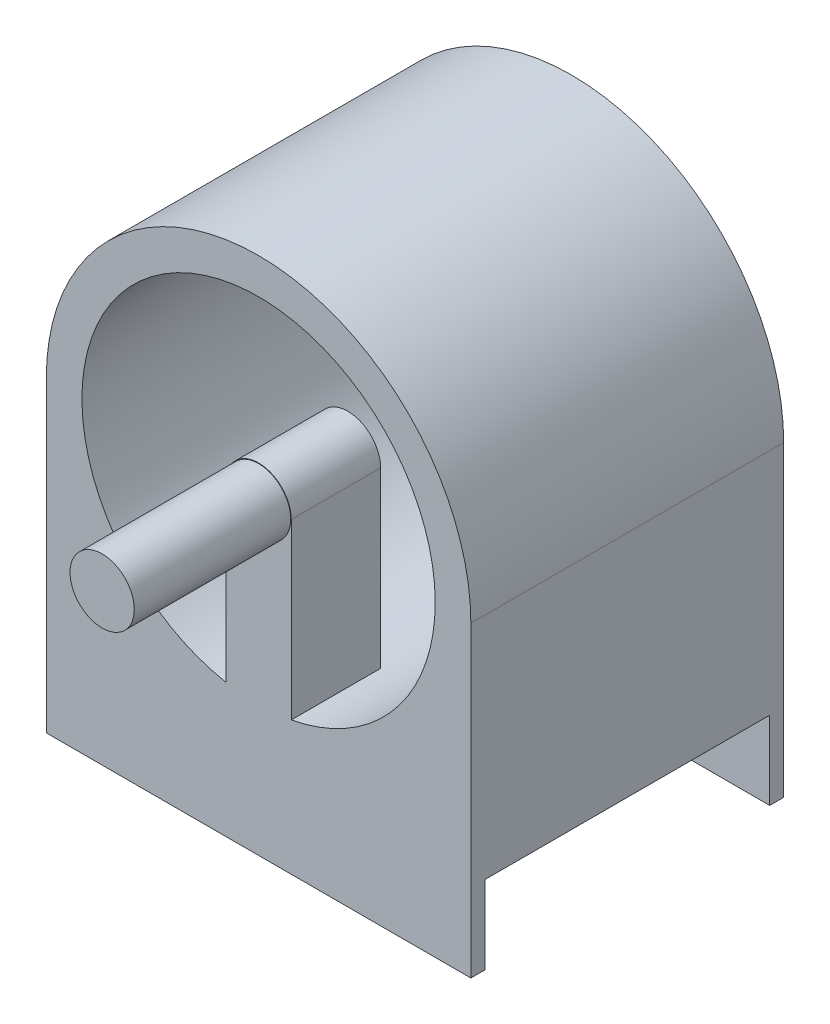
from build123d import *

# Parameters (mm, degrees)
BOSS_EXTRUDE1_DEPTH = 38
BOSS_EXTRUDE2_DEPTH = 14
SKETCH3_R           = 15.81
CUT_EXTRUDE1_DEPTH  = 67.258961658
BOSS_EXTRUDE3_DEPTH = 8
SKETCH5_R           = 2.875
BOSS_EXTRUDE4_DEPTH = 14


with BuildPart() as part:
    # Sketch1 → Boss-Extrude1 (new body)
    with BuildSketch(Plane(origin=(0, 0, 0), x_dir=(0, 0, -1), z_dir=(1, 0, 0))):
        Polygon((-12.75, 0), (-12.75, 7), (12.75, 7), (12.75, 0), (14, 0), (14, 8.5), (-14, 8.5), (-14, 0), align=None)
    extrude(amount=BOSS_EXTRUDE1_DEPTH)

    # Sketch2 → Boss-Extrude2 (add, symmetric)
    with BuildSketch(Plane.XY):
        with BuildLine():
            Line((0, 27.5), (0, 8.5))
            Line((0, 8.5), (38, 8.5))
            Line((38, 8.5), (38, 27.5))
            ThreePointArc((38, 27.5), (19, 46.5), (0, 27.5))
        make_face()
    extrude(amount=BOSS_EXTRUDE2_DEPTH, both=True)

    # Sketch3 → Cut-Extrude1 (cut, through all)
    with BuildSketch(Plane.XY.offset(14)):
        with Locations((19, 27.5)):
            Circle(SKETCH3_R)
    extrude(amount=-CUT_EXTRUDE1_DEPTH, mode=Mode.SUBTRACT)

    # Sketch4 → Boss-Extrude3 (add)
    with BuildSketch(Plane.XY.offset(14)):
        with BuildLine():
            Line((21.925, 27.5), (21.925, 11.962932226))
            ThreePointArc((21.925, 11.962932226), (19, 11.69), (16.075, 11.962932226))
            Line((16.075, 11.962932226), (16.075, 27.5))
            ThreePointArc((16.075, 27.5), (19, 30.425), (21.925, 27.5))
        make_face()
    extrude(amount=-BOSS_EXTRUDE3_DEPTH)

    # Sketch5 → Boss-Extrude4 (add)
    with BuildSketch(Plane.XY.offset(14)):
        with Locations(Location((19, 27.5, 0), (0, 0, 180))):
            Circle(SKETCH5_R)
    extrude(amount=BOSS_EXTRUDE4_DEPTH)


solid = part.part
